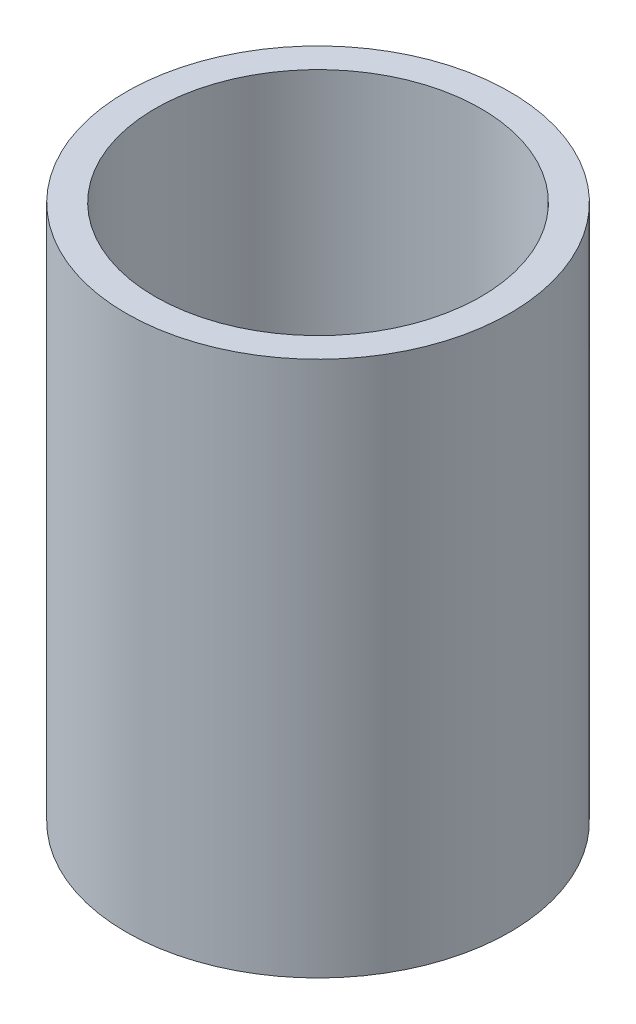
from build123d import *

# Parameters (mm, degrees)
SKETCH1_R           = 13.25
SKETCH1_R_2         = 11.25
BOSS_EXTRUDE1_DEPTH = 37


with BuildPart() as part:
    # Sketch1 → Boss-Extrude1 (new body)
    with BuildSketch(Plane(origin=(0, 0, 0), x_dir=(1, 0, 0), z_dir=(0, 1, 0))):
        with Locations(Location((0, 0, 0), (0, 0, 270))):
            Circle(SKETCH1_R)
        with Locations(Location((0, 0, 0), (0, 0, 270))):
            Circle(SKETCH1_R_2, mode=Mode.SUBTRACT)
    extrude(amount=BOSS_EXTRUDE1_DEPTH)


solid = part.part
